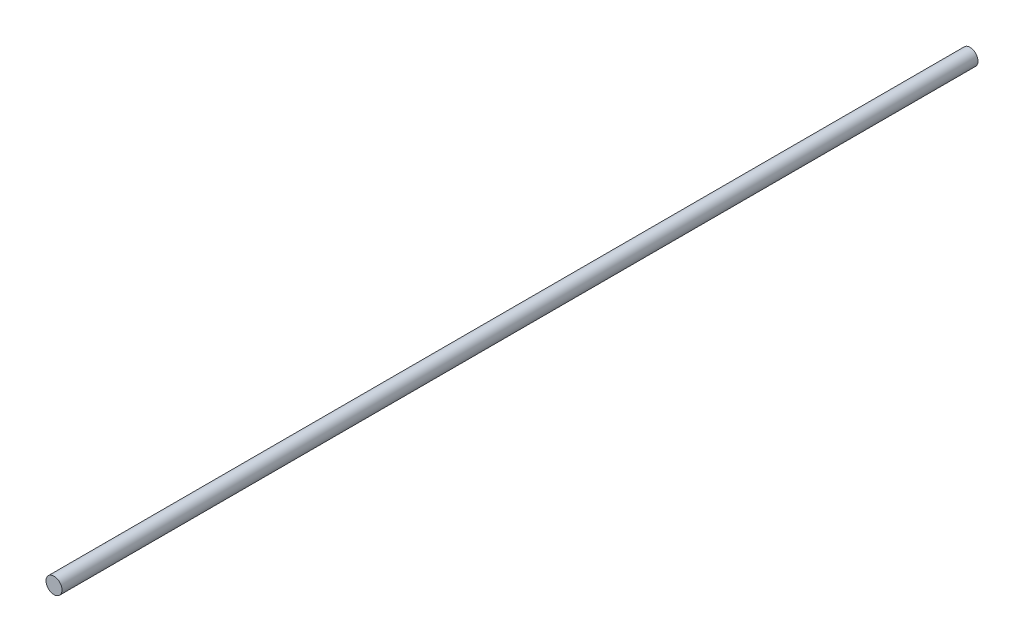
from build123d import *

# Parameters (mm, degrees)
SKETCH1_R           = 2.5
BOSS_EXTRUDE1_DEPTH = 286


with BuildPart() as part:
    # Sketch1 → Boss-Extrude1 (new body)
    with BuildSketch(Plane.XY):
        Circle(SKETCH1_R)
    extrude(amount=BOSS_EXTRUDE1_DEPTH)


solid = part.part
